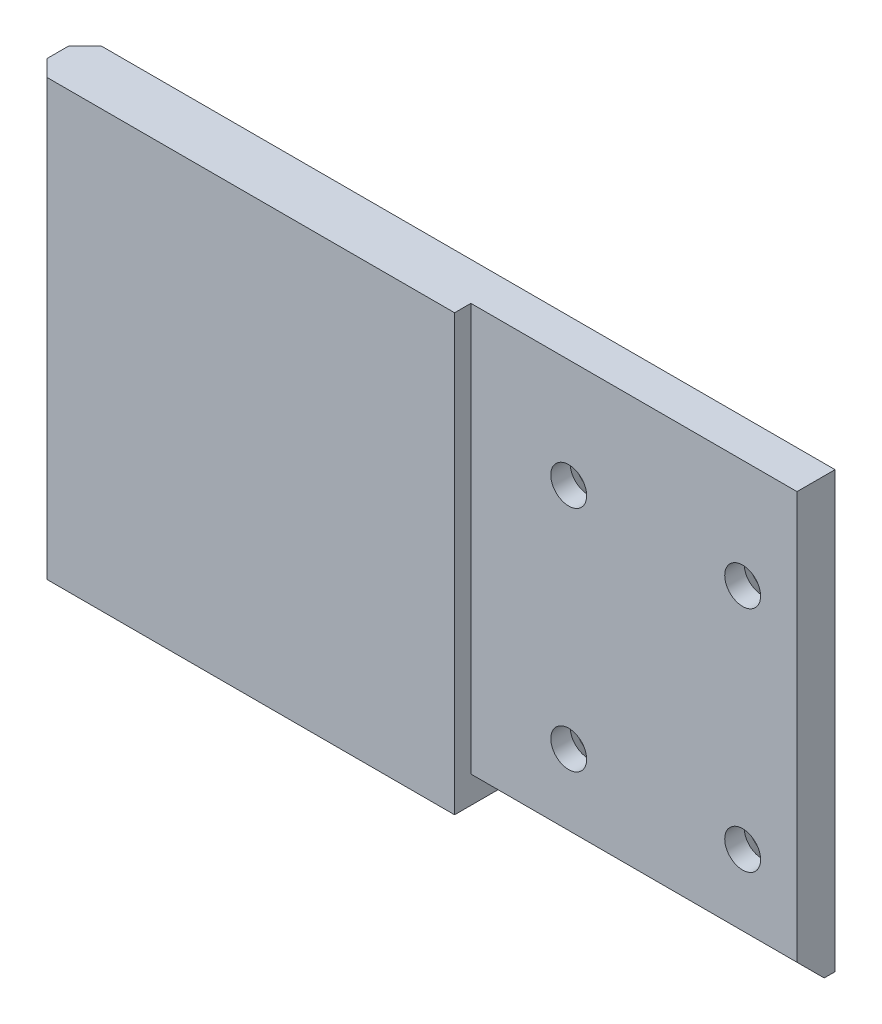
from build123d import *

# Parameters (mm, degrees)
ESBO_O1_W                                           = 138
ESBO_O1_H                                           = 80
RESSALTO_EXTRUS_O1_DEPTH                            = 10
ESBO_O2_W                                           = 60
ESBO_O2_H                                           = 80
CORTE_EXTRUS_O1_DEPTH                               = 3
ESCAREADO_PARA_PARAFUSO_ALLEN_SEXTAVADO_D           = 6.6
ESCAREADO_PARA_PARAFUSO_ALLEN_SEXTAVADO_CSINK_D     = 13.44
ESCAREADO_PARA_PARAFUSO_ALLEN_SEXTAVADO_CSINK_ANGLE = 90
CHANFRO1_SIZE                                       = 5
CHANFRO2_SIZE                                       = 3


with BuildPart() as part:
    # Esboço1 → Ressalto-extrusão1 (new body)
    with BuildSketch(Plane.XY):
        with Locations((-69, 40)):
            Rectangle(ESBO_O1_W, ESBO_O1_H)
    extrude(amount=RESSALTO_EXTRUS_O1_DEPTH)

    # Esboço2 → Corte-extrusão1 (cut)
    with BuildSketch(Plane.XY.offset(10)):
        with Locations((-30, 40)):
            Rectangle(ESBO_O2_W, ESBO_O2_H)
    extrude(amount=-CORTE_EXTRUS_O1_DEPTH, mode=Mode.SUBTRACT)

    # Escareado para parafuso Allen sextavado escareado de M62 (through all)
    with Locations(Plane(origin=(0, 0, 0), x_dir=(-1, 0, 0), z_dir=(0, 0, -1))):
        with Locations((10, 60), (42, 60), (42, 18), (10, 18)):
            CounterSinkHole(ESCAREADO_PARA_PARAFUSO_ALLEN_SEXTAVADO_D / 2, ESCAREADO_PARA_PARAFUSO_ALLEN_SEXTAVADO_CSINK_D / 2, counter_sink_angle=ESCAREADO_PARA_PARAFUSO_ALLEN_SEXTAVADO_CSINK_ANGLE)

    # Chanfro1
    chanfro1_edges = [part.edges().sort_by_distance(p)[0] for p in [
        (-30, 0, 7),
    ]]
    chamfer(chanfro1_edges, length=CHANFRO1_SIZE)

    # Chanfro2
    chanfro2_edges = [part.edges().sort_by_distance(p)[0] for p in [
        (-138, 40, 10),
        (-138, 40, 0),
    ]]
    chamfer(chanfro2_edges, length=CHANFRO2_SIZE)


solid = part.part
